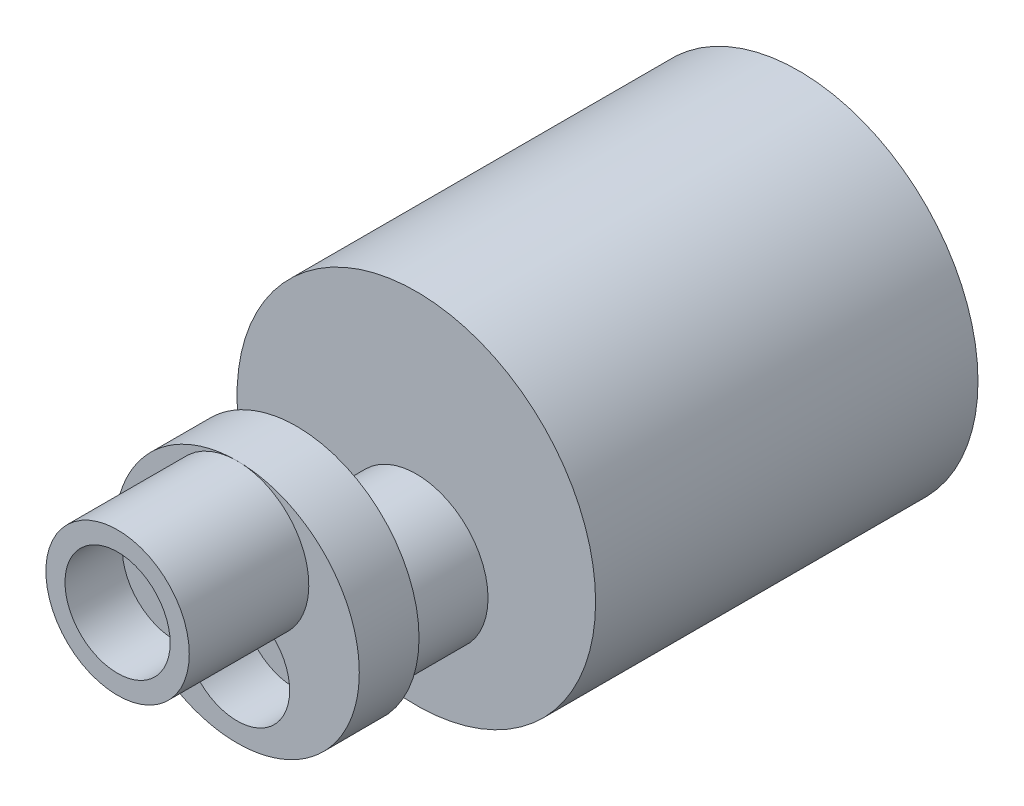
from build123d import *

# Parameters (mm, degrees)
SKETCH1_R                                           = 7.5
BOSS_EXTRUDE1_DEPTH                                 = 16
SKETCH2_R                                           = 3
BOSS_EXTRUDE2_DEPTH                                 = 5
SKETCH3_R                                           = 5.1125
BOSS_EXTRUDE3_DEPTH                                 = 2.5
SKETCH5_R                                           = 3
BOSS_EXTRUDE4_DEPTH                                 = 5
CBORE_FOR_M2_HEX_SOCKET_HEAD_CAP_SCREW1_D           = 2.4
CBORE_FOR_M2_HEX_SOCKET_HEAD_CAP_SCREW1_DEPTH       = 7.5
CBORE_FOR_M2_HEX_SOCKET_HEAD_CAP_SCREW1_CBORE_D     = 4.4
CBORE_FOR_M2_HEX_SOCKET_HEAD_CAP_SCREW1_CBORE_DEPTH = 2.4


with BuildPart() as part:
    # Sketch1 → Boss-Extrude1 (new body)
    with BuildSketch(Plane.XY):
        Circle(SKETCH1_R)
    extrude(amount=BOSS_EXTRUDE1_DEPTH)

    # Sketch2 → Boss-Extrude2 (add)
    with BuildSketch(Plane.XY.offset(16)):
        with Locations((0, -2.1125)):
            Circle(SKETCH2_R)
    extrude(amount=BOSS_EXTRUDE2_DEPTH)

    # Sketch3 → Boss-Extrude3 (add)
    with BuildSketch(Plane.XY.offset(21)):
        with Locations(Location((0, 0, 0), (0, 0, 270))):
            Circle(SKETCH3_R)
    extrude(amount=BOSS_EXTRUDE3_DEPTH)

    # Sketch5 → Boss-Extrude4 (add)
    with BuildSketch(Plane.XY.offset(23.5)):
        with Locations(Location((0, 2.1125, 0), (0, 0, 90))):
            Circle(SKETCH5_R)
    extrude(amount=BOSS_EXTRUDE4_DEPTH)

    # CBORE for M2 Hex Socket Head Cap Screw1
    with Locations(Plane.XY.offset(28.5)):
        with Locations((0, 2.1125)):
            CounterBoreHole(CBORE_FOR_M2_HEX_SOCKET_HEAD_CAP_SCREW1_D / 2, CBORE_FOR_M2_HEX_SOCKET_HEAD_CAP_SCREW1_CBORE_D / 2, CBORE_FOR_M2_HEX_SOCKET_HEAD_CAP_SCREW1_CBORE_DEPTH, depth=CBORE_FOR_M2_HEX_SOCKET_HEAD_CAP_SCREW1_DEPTH)

    # Sketch10 → CBORE for M2 Hex Socket Head Cap Screw2 (revolve, cut)
    with BuildSketch(Plane(origin=(0, -2.1125, 23.5), x_dir=(0, -1, 0), z_dir=(1, 0, 0))):
        Polygon((0, 0), (0, 14.721032743), (1.2, 14), (1.2, 2.4), (2.2, 2.4), (2.2, 0), align=None)
    revolve(axis=Axis((0, -2.1125, 29.85), (0, 0, -1)), mode=Mode.SUBTRACT)


solid = part.part
